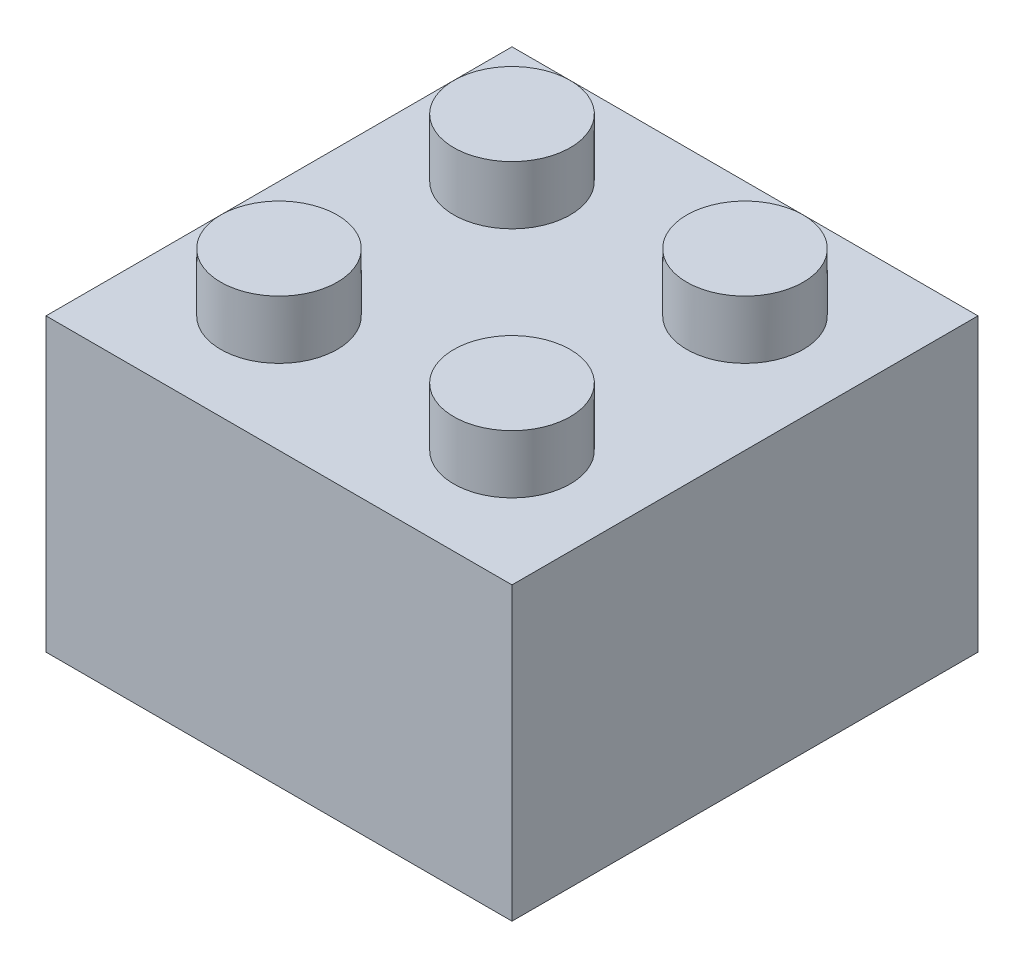
from build123d import *

# Parameters (mm, degrees)
SKETCH1_W           = 16
SKETCH1_H           = 16
BOSS_EXTRUDE1_DEPTH = 10
SKETCH2_R           = 2
BOSS_EXTRUDE2_DEPTH = 2
SHELL1_T            = -1
SKETCH3_R           = 2.7
SKETCH3_R_2         = 1.7
BOSS_EXTRUDE3_DEPTH = 9


with BuildPart() as part:
    # Sketch1 → Boss-Extrude1 (new body)
    with BuildSketch(Plane(origin=(0, 0, 0), x_dir=(1, 0, 0), z_dir=(0, 1, 0))):
        Rectangle(SKETCH1_W, SKETCH1_H)
    extrude(amount=BOSS_EXTRUDE1_DEPTH)

    # Sketch2 → Boss-Extrude2 (add)
    with BuildSketch(Plane(origin=(0, 10, 0), x_dir=(1, 0, 0), z_dir=(0, 1, 0))):
        with Locations(Location((4, 4, 0), (0, 0, 90))):
            Circle(SKETCH2_R)
        with Locations(Location((-4, 4, 0), (0, 0, 90))):
            Circle(SKETCH2_R)
        with Locations(Location((4, -4, 0), (0, 0, 90))):
            Circle(SKETCH2_R)
        with Locations(Location((-4, -4, 0), (0, 0, 90))):
            Circle(SKETCH2_R)
    extrude(amount=BOSS_EXTRUDE2_DEPTH)

    # Shell1
    shell1_openings = [part.faces().sort_by_distance(p)[0] for p in [
        (0, 0, 0),
    ]]
    offset(amount=SHELL1_T, openings=shell1_openings, kind=Kind.INTERSECTION)

    # Sketch3 → Boss-Extrude3 (add)
    with BuildSketch(Plane.XZ.offset(-9)):
        with Locations(Location((0, 0, 0), (0, 0, 270))):
            Circle(SKETCH3_R)
        with Locations(Location((0, 0, 0), (0, 0, 270))):
            Circle(SKETCH3_R_2, mode=Mode.SUBTRACT)
    extrude(amount=BOSS_EXTRUDE3_DEPTH)


solid = part.part
